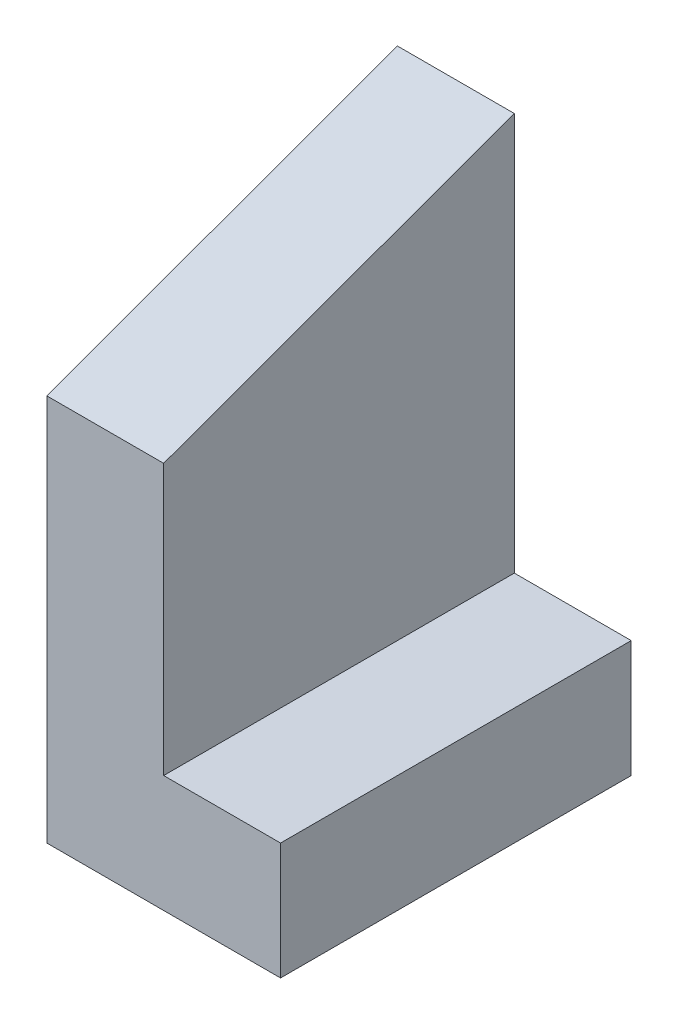
from build123d import *

# Parameters (mm, degrees)
BOSS_EXTRUDE1_DEPTH = 15
CUT_EXTRUDE1_DEPTH  = 10


with BuildPart() as part:
    # Sketch1 → Boss-Extrude1 (new body)
    with BuildSketch(Plane.XY):
        Polygon((0, 0), (0, 25), (5, 25), (5, 5), (10, 5), (10, 0), align=None)
    extrude(amount=BOSS_EXTRUDE1_DEPTH)

    # Sketch2 → Cut-Extrude1 (cut)
    with BuildSketch(Plane(origin=(5, 0, 0), x_dir=(0, 0, -1), z_dir=(1, 0, 0))):
        Polygon((-15, 16.566763504), (0, 22.026317018), (4.620112483, 27.870053484), (-25.228926909, 33.944013314), align=None)
    extrude(amount=-CUT_EXTRUDE1_DEPTH, mode=Mode.SUBTRACT)


solid = part.part
